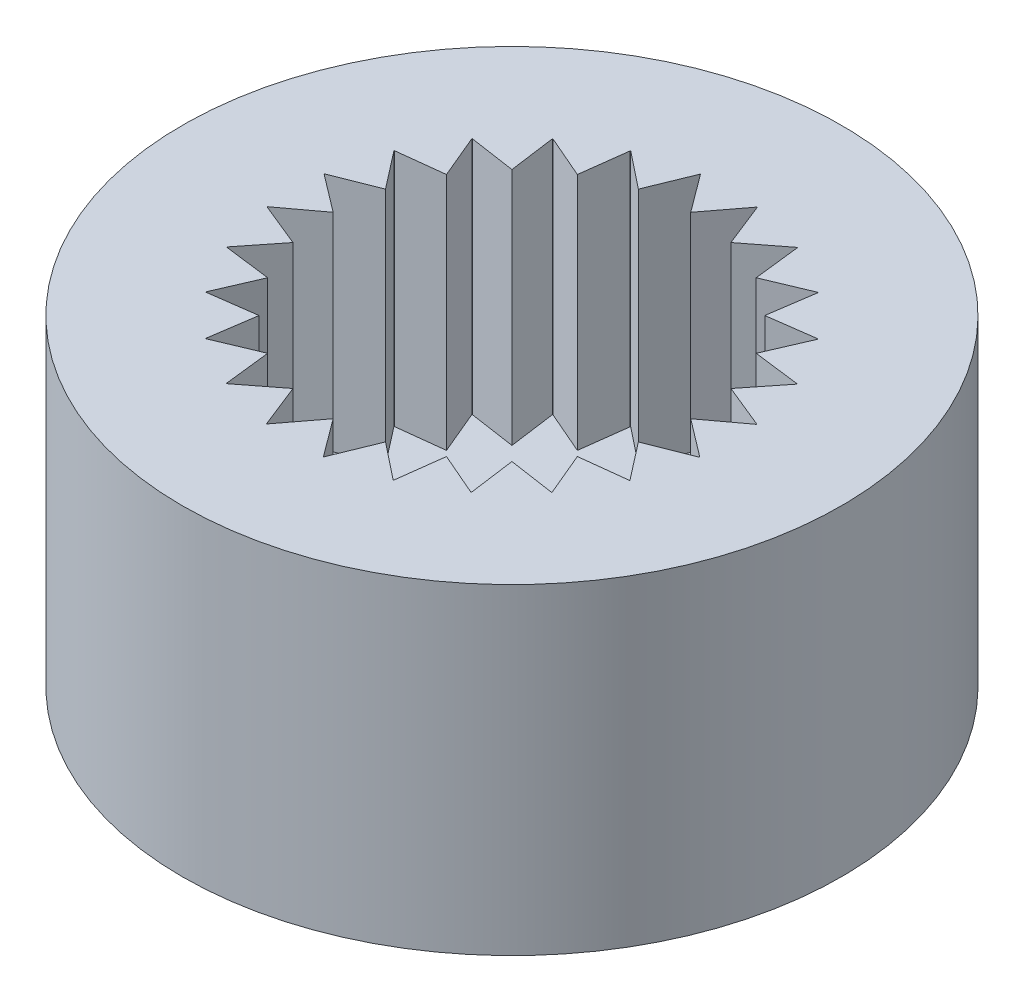
from build123d import *

# Parameters (mm, degrees)
SKETCH1_R           = 4
BOSS_EXTRUDE7_DEPTH = 1
BOSS_EXTRUDE8_START = 1
SKETCH1_4_R         = 4
BOSS_EXTRUDE8_DEPTH = 2.9


with BuildPart() as part:
    # Sketch1 → Boss-Extrude7 (new body)
    with BuildSketch(Plane(origin=(0, 0, 0), x_dir=(1, 0, 0), z_dir=(0, 1, 0))):
        with Locations(Location((0, 0, 0), (0, 0, 270))):
            Circle(SKETCH1_R)
    extrude(amount=BOSS_EXTRUDE7_DEPTH)

    # Sketch1<4> → Boss-Extrude8 (add)
    with BuildSketch(Plane(origin=(0, 0, 0), x_dir=(1, 0, 0), z_dir=(0, 1, 0)).offset(BOSS_EXTRUDE8_START)):
        with Locations(Location((0, 0, 0), (0, 0, 270))):
            Circle(SKETCH1_4_R)
        with BuildLine():
            Line((-0.34, 2.628098172), (0, 2.17))
            Line((0, 2.17), (0.3473, 2.627143451))
            ThreePointArc((0.3473, 2.627143451), (0.349543667, 2.62684587), (0.351787078, 2.626546373))
            Line((0.351787078, 2.626546373), (0.561637328, 2.096059043))
            Line((0.561637328, 2.096059043), (1.015420799, 2.447737854))
            ThreePointArc((1.015420799, 2.447737854), (1.017510995, 2.44686971), (1.019600449, 2.44599978))
            Line((1.019600449, 2.44599978), (1.085, 1.879275126))
            Line((1.085, 1.879275126), (1.614342348, 2.101522968))
            ThreePointArc((1.614342348, 2.101522968), (1.61613663, 2.100143422), (1.617929733, 2.098762344))
            Line((1.617929733, 2.098762344), (1.534421715, 1.534421715))
            Line((1.534421715, 1.534421715), (2.103249134, 1.612092764))
            ThreePointArc((2.103249134, 1.612092764), (2.104625225, 1.610295831), (2.10599978, 1.608497723))
            Line((2.10599978, 1.608497723), (1.879275126, 1.085))
            Line((1.879275126, 1.085), (2.448822968, 1.012801103))
            ThreePointArc((2.448822968, 1.012801103), (2.449687089, 1.01070924), (2.450549423, 1.00861664))
            Line((2.450549423, 1.00861664), (2.096059043, 0.561637328))
            Line((2.096059043, 0.561637328), (2.627513563, 0.34448872))
            ThreePointArc((2.627513563, 0.34448872), (2.627806826, 0.342244485), (2.628098172, 0.34))
            Line((2.628098172, 0.34), (2.17, 0))
            Line((2.17, 0), (2.627143451, -0.3473))
            ThreePointArc((2.627143451, -0.3473), (2.62684587, -0.349543667), (2.626546373, -0.351787078))
            Line((2.626546373, -0.351787078), (2.096059043, -0.561637328))
            Line((2.096059043, -0.561637328), (2.447737854, -1.015420799))
            ThreePointArc((2.447737854, -1.015420799), (2.44686971, -1.017510995), (2.44599978, -1.019600449))
            Line((2.44599978, -1.019600449), (1.879275126, -1.085))
            Line((1.879275126, -1.085), (2.101522968, -1.614342348))
            ThreePointArc((2.101522968, -1.614342348), (2.100143422, -1.61613663), (2.098762344, -1.617929733))
            Line((2.098762344, -1.617929733), (1.534421715, -1.534421715))
            Line((1.534421715, -1.534421715), (1.612092764, -2.103249134))
            ThreePointArc((1.612092764, -2.103249134), (1.610295831, -2.104625225), (1.608497723, -2.10599978))
            Line((1.608497723, -2.10599978), (1.085, -1.879275126))
            Line((1.085, -1.879275126), (1.012801103, -2.448822968))
            ThreePointArc((1.012801103, -2.448822968), (1.01070924, -2.449687089), (1.00861664, -2.450549423))
            Line((1.00861664, -2.450549423), (0.561637328, -2.096059043))
            Line((0.561637328, -2.096059043), (0.34448872, -2.627513563))
            ThreePointArc((0.34448872, -2.627513563), (0.342244485, -2.627806826), (0.34, -2.628098172))
            Line((0.34, -2.628098172), (0, -2.17))
            Line((0, -2.17), (-0.3473, -2.627143451))
            ThreePointArc((-0.3473, -2.627143451), (-0.349543667, -2.62684587), (-0.351787078, -2.626546373))
            Line((-0.351787078, -2.626546373), (-0.561637328, -2.096059043))
            Line((-0.561637328, -2.096059043), (-1.015420799, -2.447737854))
            ThreePointArc((-1.015420799, -2.447737854), (-1.017510995, -2.44686971), (-1.019600449, -2.44599978))
            Line((-1.019600449, -2.44599978), (-1.085, -1.879275126))
            Line((-1.085, -1.879275126), (-1.614342348, -2.101522968))
            ThreePointArc((-1.614342348, -2.101522968), (-1.61613663, -2.100143422), (-1.617929733, -2.098762344))
            Line((-1.617929733, -2.098762344), (-1.534421715, -1.534421715))
            Line((-1.534421715, -1.534421715), (-2.103249134, -1.612092764))
            ThreePointArc((-2.103249134, -1.612092764), (-2.104625225, -1.610295831), (-2.10599978, -1.608497723))
            Line((-2.10599978, -1.608497723), (-1.879275126, -1.085))
            Line((-1.879275126, -1.085), (-2.448822968, -1.012801103))
            ThreePointArc((-2.448822968, -1.012801103), (-2.449687089, -1.01070924), (-2.450549423, -1.00861664))
            Line((-2.450549423, -1.00861664), (-2.096059043, -0.561637328))
            Line((-2.096059043, -0.561637328), (-2.627513563, -0.34448872))
            ThreePointArc((-2.627513563, -0.34448872), (-2.627806826, -0.342244485), (-2.628098172, -0.34))
            Line((-2.628098172, -0.34), (-2.17, 0))
            Line((-2.17, 0), (-2.627143451, 0.3473))
            ThreePointArc((-2.627143451, 0.3473), (-2.62684587, 0.349543667), (-2.626546373, 0.351787078))
            Line((-2.626546373, 0.351787078), (-2.096059043, 0.561637328))
            Line((-2.096059043, 0.561637328), (-2.447737854, 1.015420799))
            ThreePointArc((-2.447737854, 1.015420799), (-2.44686971, 1.017510995), (-2.44599978, 1.019600449))
            Line((-2.44599978, 1.019600449), (-1.879275126, 1.085))
            Line((-1.879275126, 1.085), (-2.101522968, 1.614342348))
            ThreePointArc((-2.101522968, 1.614342348), (-2.100143422, 1.61613663), (-2.098762344, 1.617929733))
            Line((-2.098762344, 1.617929733), (-1.534421715, 1.534421715))
            Line((-1.534421715, 1.534421715), (-1.612092764, 2.103249134))
            ThreePointArc((-1.612092764, 2.103249134), (-1.610295831, 2.104625225), (-1.608497723, 2.10599978))
            Line((-1.608497723, 2.10599978), (-1.085, 1.879275126))
            Line((-1.085, 1.879275126), (-1.012801103, 2.448822968))
            ThreePointArc((-1.012801103, 2.448822968), (-1.01070924, 2.449687089), (-1.00861664, 2.450549423))
            Line((-1.00861664, 2.450549423), (-0.561637328, 2.096059043))
            Line((-0.561637328, 2.096059043), (-0.34448872, 2.627513563))
            ThreePointArc((-0.34448872, 2.627513563), (-0.342244485, 2.627806826), (-0.34, 2.628098172))
        make_face(mode=Mode.SUBTRACT)
    extrude(amount=BOSS_EXTRUDE8_DEPTH)


solid = part.part
